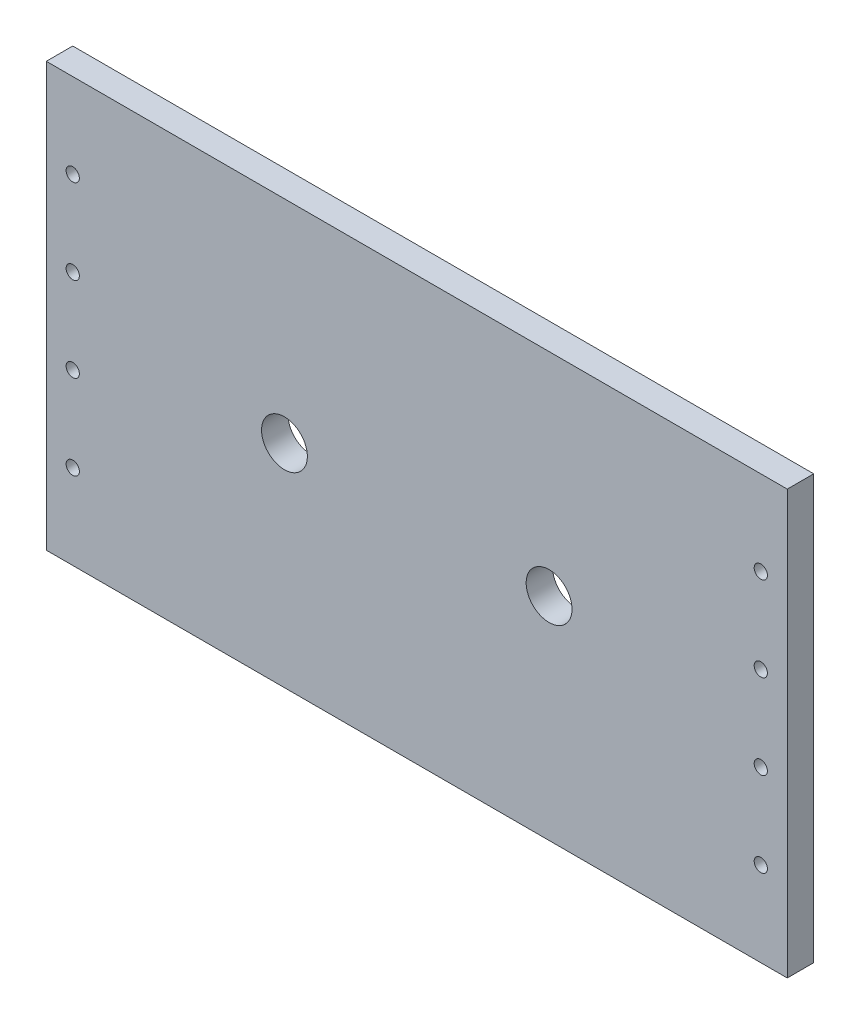
from build123d import *

# Parameters (mm, degrees)
SKETCH1_W           = 177.8
SKETCH1_H           = 101.6
BOSS_EXTRUDE1_DEPTH = 6.35
SKETCH2_R           = 1.5875
CUT_EXTRUDE1_DEPTH  = 6.35
SKETCH5_R           = 5.499261314
CUT_EXTRUDE3_DEPTH  = 6.35


with BuildPart() as part:
    # Sketch1 → Boss-Extrude1 (new body)
    with BuildSketch(Plane.XY):
        with Locations((88.9, 50.8)):
            Rectangle(SKETCH1_W, SKETCH1_H)
    extrude(amount=BOSS_EXTRUDE1_DEPTH)

    # Sketch2 → Cut-Extrude1 (cut)
    with BuildSketch(Plane.XY.offset(6.35)):
        with Locations((6.35, 81.28)):
            Circle(SKETCH2_R)
        with Locations((6.35, 60.96)):
            Circle(SKETCH2_R)
        with Locations((6.35, 40.64)):
            Circle(SKETCH2_R)
        with Locations((6.35, 20.32)):
            Circle(SKETCH2_R)
        with Locations((171.45, 20.32)):
            Circle(SKETCH2_R)
        with Locations((171.45, 40.64)):
            Circle(SKETCH2_R)
        with Locations((171.45, 60.96)):
            Circle(SKETCH2_R)
        with Locations((171.45, 81.28)):
            Circle(SKETCH2_R)
    extrude(amount=-CUT_EXTRUDE1_DEPTH, mode=Mode.SUBTRACT)

    # Sketch5 → Cut-Extrude3 (cut)
    with BuildSketch(Plane.XY.offset(6.35)):
        with Locations((120.65, 50.8)):
            Circle(SKETCH5_R)
        with Locations((57.15, 50.8)):
            Circle(SKETCH5_R)
    extrude(amount=-CUT_EXTRUDE3_DEPTH, mode=Mode.SUBTRACT)


solid = part.part
